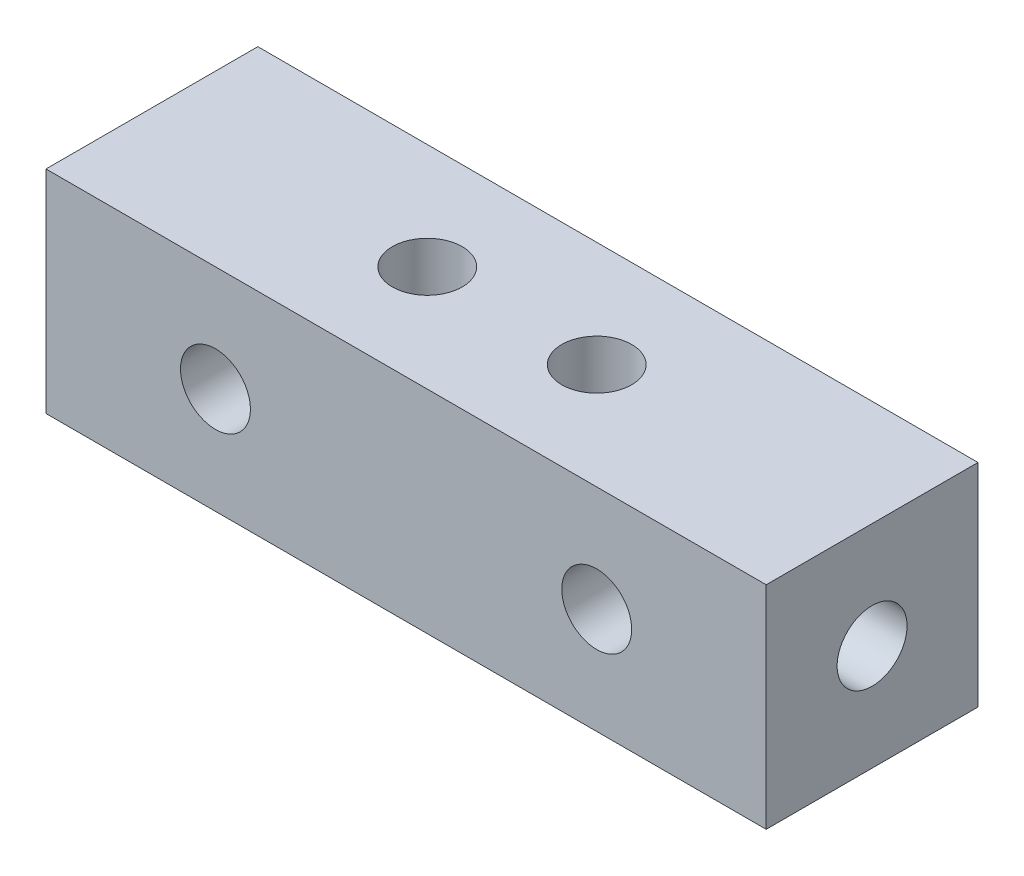
from build123d import *

# Parameters (mm, degrees)
SKETCH_1_W         = 34
SKETCH_1_H         = 10
EXTRUDE_1_DEPTH    = 10
HOLE_WIZARD_M4_1_D = 3.3
HOLE_WIZARD_M4_2_D = 3.3
HOLE_WIZARD_M4_3_D = 3.3
HOLE_WIZARD_M4_4_D = 3.3
HOLE_WIZARD_M4_5_D = 3.3


with BuildPart() as part:
    # 草图1 → 凸台-拉伸1 (new body)
    with BuildSketch(Plane.XY):
        Rectangle(SKETCH_1_W, SKETCH_1_H)
    extrude(amount=EXTRUDE_1_DEPTH)

    # M4 螺纹孔的螺纹孔钻头1 (through all)
    with Locations(Plane(origin=(17, 0, 5), x_dir=(0, 0, 1), z_dir=(1, 0, 0))):
        with Locations((0, 0)):
            Hole(HOLE_WIZARD_M4_1_D / 2)

    # M4 螺纹孔的螺纹孔钻头2 (through all)
    with Locations(Plane(origin=(4, 5, 5), x_dir=(1, 0, 0), z_dir=(0, 1, 0))):
        with Locations((0, 0)):
            Hole(HOLE_WIZARD_M4_2_D / 2)

    # M4 螺纹孔的螺纹孔钻头3 (through all)
    with Locations(Plane(origin=(-4, 5, 5), x_dir=(1, 0, 0), z_dir=(0, 1, 0))):
        with Locations((0, 0)):
            Hole(HOLE_WIZARD_M4_3_D / 2)

    # M4 螺纹孔的螺纹孔钻头4 (through all)
    with Locations(Plane(origin=(9, 0, 0), x_dir=(-1, 0, 0), z_dir=(0, 0, -1))):
        with Locations((0, 0)):
            Hole(HOLE_WIZARD_M4_4_D / 2)

    # M4 螺纹孔的螺纹孔钻头5 (through all)
    with Locations(Plane(origin=(-9, 0, 0), x_dir=(-1, 0, 0), z_dir=(0, 0, -1))):
        with Locations((0, 0)):
            Hole(HOLE_WIZARD_M4_5_D / 2)


solid = part.part
